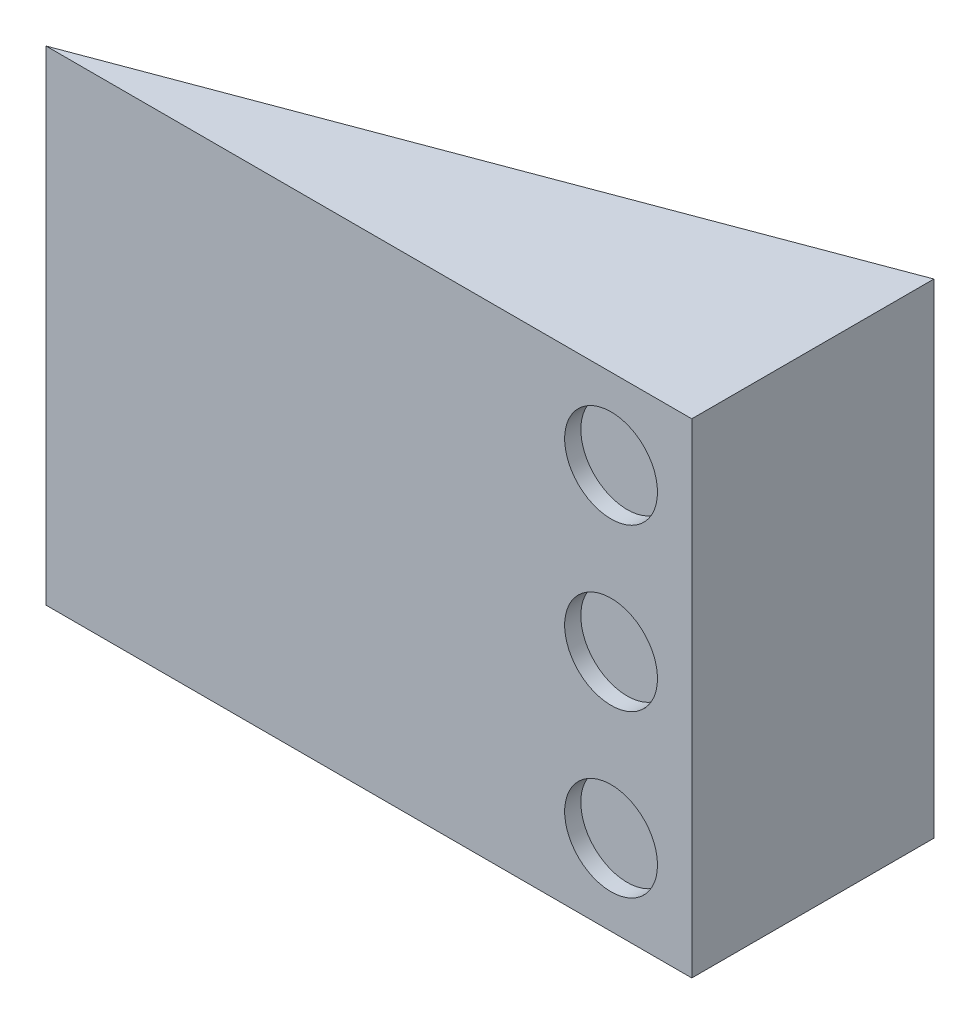
from build123d import *

# Parameters (mm, degrees)
EXTRUDE_1_DEPTH     = 60
SKETCH_2_R          = 5.75
CUT_EXTRUDE_1_DEPTH = 2


with BuildPart() as part:
    # 草图1 → 凸台-拉伸1 (new body)
    with BuildSketch(Plane(origin=(0, 0, 0), x_dir=(1, 0, 0), z_dir=(0, 1, 0))):
        Polygon((0, 0), (80, 30), (80, 0), align=None)
    extrude(amount=EXTRUDE_1_DEPTH)

    # 草图2 → 切除-拉伸1 (cut)
    with BuildSketch(Plane.XY):
        with Locations((70, 50)):
            Circle(SKETCH_2_R)
        with Locations((70, 30)):
            Circle(SKETCH_2_R)
        with Locations((70, 10)):
            Circle(SKETCH_2_R)
    extrude(amount=-CUT_EXTRUDE_1_DEPTH, mode=Mode.SUBTRACT)


solid = part.part
